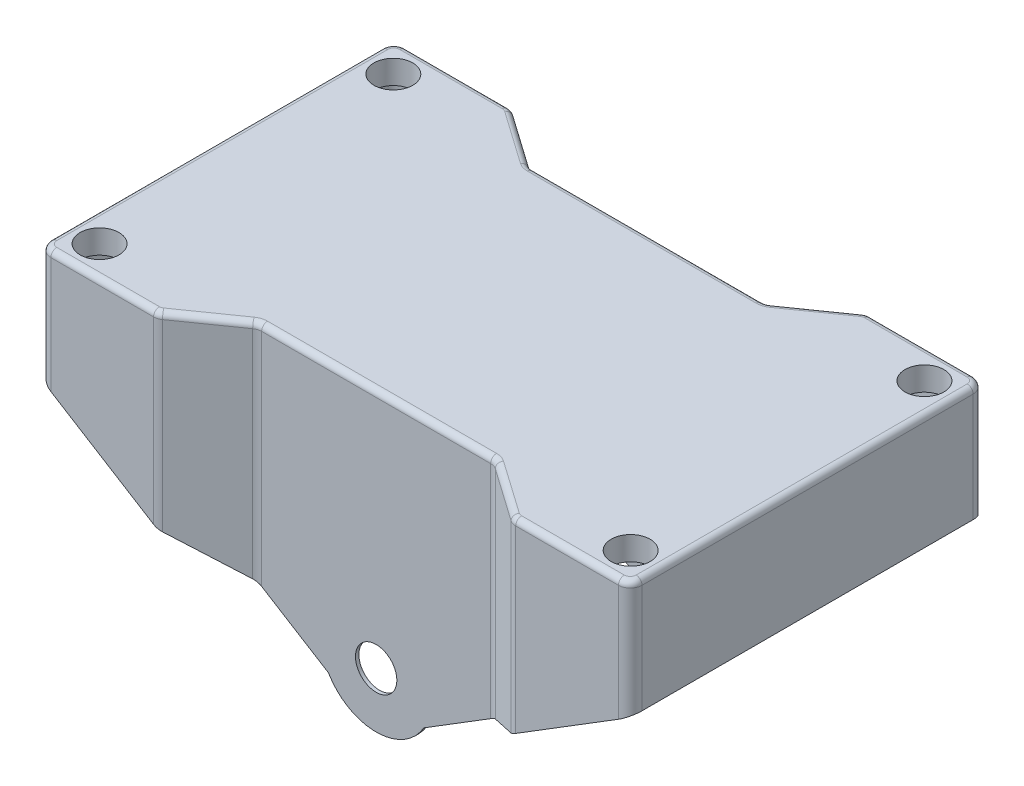
from build123d import *

# Parameters (mm, degrees)
SKETCH1_R           = 3.286752884
BOSS_EXTRUDE2_DEPTH = 50
FILLET1_R           = 2
FILLET2_R           = 1
CUT_EXTRUDE1_DEPTH  = 70
SKETCH3_W           = 0.91909433
SKETCH3_H           = 44.79975758
CUT_EXTRUDE3_DEPTH  = 46


with BuildPart() as part:
    # Sketch1 → Boss-Extrude2 (new body)
    with BuildSketch(Plane(origin=(0, 0, 0), x_dir=(1, 0, 0), z_dir=(0, 1, 0))):
        Polygon((-50, -30), (-50, 30), (-30, 30), (-20, 22.979280262), (20, 22.979280262), (30, 30), (50, 30), (50, -30), (30, -30), (20, -22.979280262), (-20, -22.979280262), (-30, -30), align=None)
        with Locations(Location((-44.920732924, 24.848491151, 0), (0, 0, 270))):
            Circle(SKETCH1_R, mode=Mode.SUBTRACT)
        with Locations(Location((-44.920732924, -24.848491151, 0), (0, 0, 90))):
            Circle(SKETCH1_R, mode=Mode.SUBTRACT)
        with Locations(Location((44.920732924, -24.848491151, 0), (0, 0, 270))):
            Circle(SKETCH1_R, mode=Mode.SUBTRACT)
        with Locations(Location((44.920732924, 24.848491151, 0), (0, 0, 90))):
            Circle(SKETCH1_R, mode=Mode.SUBTRACT)
    extrude(amount=-BOSS_EXTRUDE2_DEPTH)

    # Fillet1
    fillet1_edges = [part.edges().sort_by_distance(p)[0] for p in [
        (-30, -25, -30),
        (-20, -25, -22.979280262),
        (20, -25, -22.979280262),
        (30, -25, -30),
        (50, -25, -30),
        (50, -25, 30),
        (30, -25, 30),
        (20, -25, 22.979280262),
        (-20, -25, 22.979280262),
        (-30, -25, 30),
        (-50, -25, 30),
        (-50, -25, -30),
    ]]
    fillet(fillet1_edges, radius=FILLET1_R)

    # Fillet2
    fillet2_edges = [part.edges().sort_by_distance(p)[0] for p in [
        (-39.315986035, 0, -30),
        (-50, 0, 0),
        (-39.315986035, 0, 30),
        (-25, 0, 26.489640131),
        (0, 0, 22.979280262),
        (25, 0, 26.489640131),
        (39.315986035, 0, 30),
        (50, 0, 0),
        (39.315986035, 0, -30),
        (25, 0, -26.489640131),
        (0, 0, -22.979280262),
        (-25, 0, -26.489640131),
        (-49.414213562, 0, 29.414213562),
        (-30.029368482, 0, 29.907057659),
        (30.029368482, 0, 29.907057659),
        (49.414213562, 0, 29.414213562),
        (49.414213562, 0, -29.414213562),
        (30.029368482, 0, -29.907057659),
        (-30.029368482, 0, -29.907057659),
        (-49.414213562, 0, -29.414213562),
        (-19.970631518, 0, -23.072222603),
        (19.970631518, 0, -23.072222603),
        (19.970631518, 0, 23.072222603),
        (-19.970631518, 0, 23.072222603),
    ]]
    fillet(fillet2_edges, radius=FILLET2_R)

    # Sketch2 → Cut-Extrude1 (cut)
    with BuildSketch(Plane.XY.offset(30)):
        Polygon((-48, -50), (-30.631972071, -50), (-30.631972071, -31.387227089), (-48, -20.62903259), align=None)
        with BuildLine():
            Line((-30.631972071, -50), (-0.459547165, -50))
            ThreePointArc((-0.459547165, -50), (-4.852357389, -48.649438504), (-8.06664868, -45.364757467))
            Line((-8.06664868, -45.364757467), (-30.631972071, -31.387227089))
            Line((-30.631972071, -31.387227089), (-30.631972071, -50))
        make_face()
        with BuildLine():
            ThreePointArc((8.06664868, -45.364757467), (4.852357389, -48.649438504), (0.459547165, -50))
            Line((0.459547165, -50), (50, -50))
            Line((50, -50), (50, -19.390182152))
            Line((50, -19.390182152), (8.06664868, -45.364757467))
        make_face()
        Polygon((-50, -50), (-48, -50), (-48, -20.62903259), (-50, -19.390182152), align=None)
        with BuildLine():
            ThreePointArc((3.5, -40.686020198), (2.474873734, -38.211146463), (0, -37.186020198))
            Line((0, -37.186020198), (0, -44.186020198))
            ThreePointArc((0, -44.186020198), (2.474873734, -43.160893932), (3.5, -40.686020198))
        make_face()
        with BuildLine():
            Line((0, -44.186020198), (0, -37.186020198))
            ThreePointArc((0, -37.186020198), (-3.5, -40.686020198), (0, -44.186020198))
        make_face()
    extrude(amount=-CUT_EXTRUDE1_DEPTH, mode=Mode.SUBTRACT)

    # Sketch3 → Cut-Extrude3 (cut)
    with BuildSketch(Plane.XZ.offset(50)):
        with BuildLine():
            Line((-0.459547165, -22.39987879), (-0.459547165, 22.39987879))
            Line((-0.459547165, 22.39987879), (-20.353496243, 22.39987879))
            Line((-20.353496243, 22.39987879), (-30.352042537, 29.450884636))
            Line((-30.352042537, 29.450884636), (-47.491946123, 29.450884636))
            ThreePointArc((-47.491946123, 29.450884636), (-48.906159685, 28.865098198), (-49.491946123, 27.450884636))
            Line((-49.491946123, 27.450884636), (-49.491946123, 0.606224364))
            Line((-49.491946123, 0.606224364), (-49.491946123, 0))
            Line((-49.491946123, 0), (-49.491946123, -0.606224364))
            Line((-49.491946123, -0.606224364), (-49.491946123, -27.450884636))
            ThreePointArc((-49.491946123, -27.450884636), (-48.906159685, -28.865098198), (-47.491946123, -29.450884636))
            Line((-47.491946123, -29.450884636), (-30.352042537, -29.450884636))
            Line((-30.352042537, -29.450884636), (-20.353496243, -22.39987879))
            Line((-20.353496243, -22.39987879), (-0.459547165, -22.39987879))
        make_face()
        Rectangle(SKETCH3_W, SKETCH3_H)
        with BuildLine():
            Line((47.491946123, 29.450884636), (30.352042537, 29.450884636))
            Line((30.352042537, 29.450884636), (20.353496243, 22.39987879))
            Line((20.353496243, 22.39987879), (0.459547165, 22.39987879))
            Line((0.459547165, 22.39987879), (0.459547165, -22.39987879))
            Line((0.459547165, -22.39987879), (20.353496243, -22.39987879))
            Line((20.353496243, -22.39987879), (30.352042537, -29.450884636))
            Line((30.352042537, -29.450884636), (47.491946123, -29.450884636))
            ThreePointArc((47.491946123, -29.450884636), (48.906159685, -28.865098198), (49.491946123, -27.450884636))
            Line((49.491946123, -27.450884636), (49.491946123, -0.606224364))
            Line((49.491946123, -0.606224364), (49.491946123, 0.606224364))
            Line((49.491946123, 0.606224364), (49.491946123, 27.450884636))
            ThreePointArc((49.491946123, 27.450884636), (48.906159685, 28.865098198), (47.491946123, 29.450884636))
        make_face()
    extrude(amount=-CUT_EXTRUDE3_DEPTH, mode=Mode.SUBTRACT)


solid = part.part
